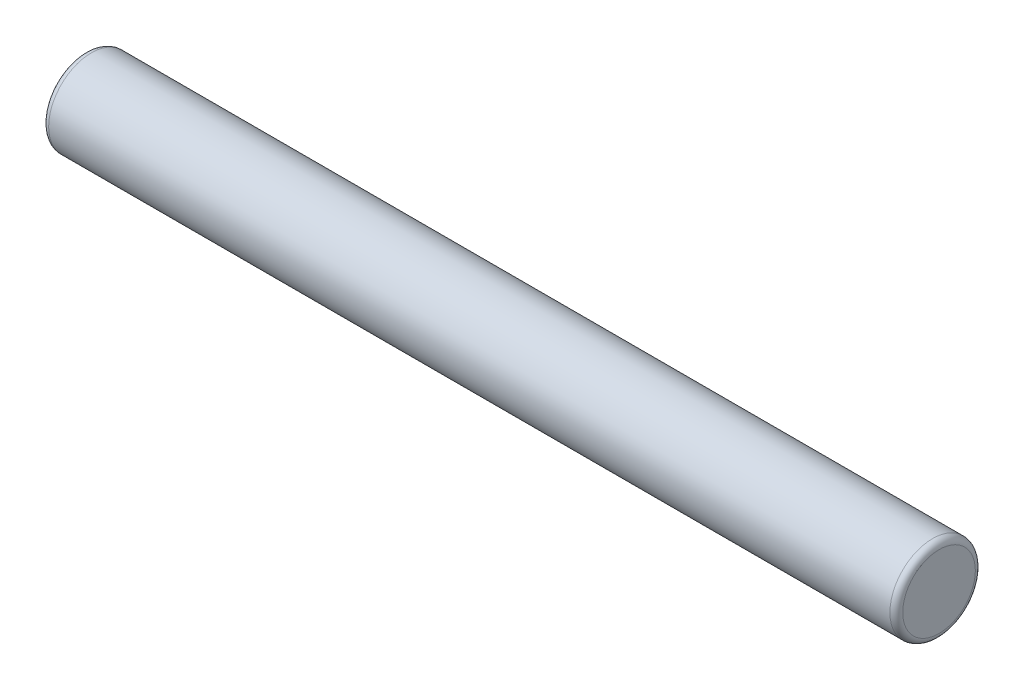
from build123d import *

# Parameters (mm, degrees)
ESQUISSE2_W = 40
ESQUISSE2_H = 2
CONG_1_R    = 0.3


with BuildPart() as part:
    # Esquisse2 → Révolution1 (revolve)
    with BuildSketch(Plane.XY, mode=Mode.PRIVATE) as r_volution1_sk:
        with Locations((20, 1)):
            Rectangle(ESQUISSE2_W, ESQUISSE2_H)
    revolve(r_volution1_sk.sketch.rotate(Axis((0, 2, 0), (1, 0, 0)), 270), axis=Axis((0, 2, 0), (1, 0, 0)))

    # Congé1
    cong_1_edges = [part.edges().sort_by_distance(p)[0] for p in [
        (0, 2, -2),
        (40, 2, -2),
    ]]
    fillet(cong_1_edges, radius=CONG_1_R)


solid = part.part
